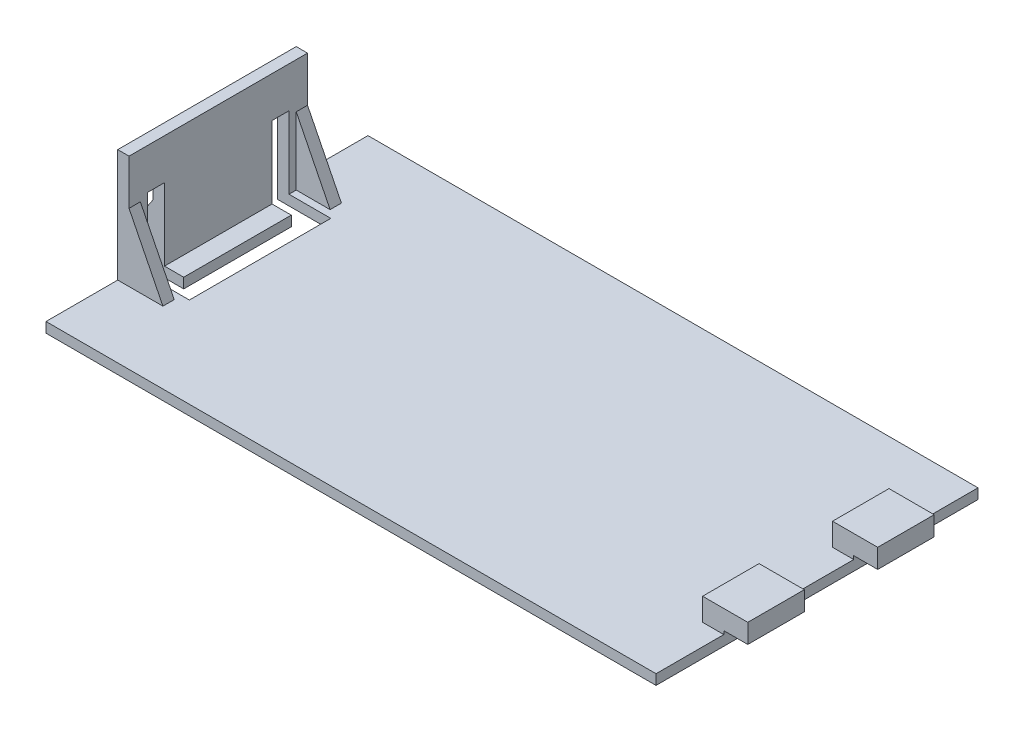
from build123d import *

# Parameters (mm, degrees)
SALIENTE_EXTRUIR1_DEPTH  = 0.9
CROQUIS2_W               = 1.87835833
CROQUIS2_H               = 5
SALIENTE_EXTRUIR2_DEPTH  = 0.3
CROQUIS3_W               = 4
CROQUIS3_H               = 5
SALIENTE_EXTRUIR4_DEPTH  = 1.7
CROQUIS4_W               = 4
CROQUIS4_H               = 5
SALIENTE_EXTRUIR5_DEPTH  = 1.7
CROQUIS5_W               = 1
CROQUIS5_H               = 15.8
SALIENTE_EXTRUIR6_DEPTH  = 10
SALIENTE_EXTRUIR8_START  = -3.14
SALIENTE_EXTRUIR8_DEPTH  = 2.16
SALIENTE_EXTRUIR9_START  = -3.14
SALIENTE_EXTRUIR9_DEPTH  = 2.16
SALIENTE_EXTRUIR10_DEPTH = 1
SALIENTE_EXTRUIR11_DEPTH = 1
CROQUIS14_W              = 1.5
CROQUIS14_H              = 7.3
CORTAR_EXTRUIR1_DEPTH    = 4.7
CROQUIS16_W              = 2
CROQUIS16_H              = 9.52
CORTAR_EXTRUIR2_DEPTH    = 4.7


with BuildPart() as part:
    # Croquis1 → Saliente-Extruir1 (new body)
    with BuildSketch(Plane(origin=(0, 0, 0), x_dir=(1, 0, 0), z_dir=(0, 1, 0))):
        Polygon((-13.741322015, -0.507016954), (-13.741322015, -12.507016954), (40.258677985, -12.507016954), (40.258677985, 15.992983046), (-13.741322015, 15.992983046), (-13.741322015, 3.992983046), (-15.191322015, 3.992983046), (-15.191322015, -0.507016954), align=None)
    extrude(amount=SALIENTE_EXTRUIR1_DEPTH)

    # Croquis2 → Saliente-Extruir2 (add)
    with BuildSketch(Plane(origin=(0, 0.9, 0), x_dir=(1, 0, 0), z_dir=(0, 1, 0))):
        with Locations((39.31949882, -4.007016954)):
            Rectangle(CROQUIS2_W, CROQUIS2_H)
        with Locations((39.31949882, 7.492983046)):
            Rectangle(CROQUIS2_W, CROQUIS2_H)
    extrude(amount=SALIENTE_EXTRUIR2_DEPTH)

    # Croquis3 → Saliente-Extruir4 (add)
    with BuildSketch(Plane(origin=(0, 1.2, 0), x_dir=(1, 0, 0), z_dir=(0, 1, 0))):
        with Locations((40.380319655, -4.007016954)):
            Rectangle(CROQUIS3_W, CROQUIS3_H)
    extrude(amount=SALIENTE_EXTRUIR4_DEPTH)

    # Croquis4 → Saliente-Extruir5 (add)
    with BuildSketch(Plane(origin=(0, 1.2, 0), x_dir=(1, 0, 0), z_dir=(0, 1, 0))):
        with Locations((40.380319655, 7.492983046)):
            Rectangle(CROQUIS4_W, CROQUIS4_H)
    extrude(amount=SALIENTE_EXTRUIR5_DEPTH)

    # Croquis5 → Saliente-Extruir6 (add)
    with BuildSketch(Plane(origin=(0, 0.9, 0), x_dir=(1, 0, 0), z_dir=(0, 1, 0))):
        with Locations((-13.241322015, 1.742983046)):
            Rectangle(CROQUIS5_W, CROQUIS5_H)
    extrude(amount=SALIENTE_EXTRUIR6_DEPTH)

    # Croquis6 → Saliente-Extruir8 (add)
    with BuildSketch(Plane(origin=(0, 0, -9.642983046), x_dir=(-1, 0, 0), z_dir=(0, 0, -1)).offset(SALIENTE_EXTRUIR8_START)):
        Polygon((13.741322015, 2.5), (13.741322015, 5.5), (15.741322015, 2.5), align=None)
    extrude(amount=-SALIENTE_EXTRUIR8_DEPTH)

    # Croquis9 → Saliente-Extruir9 (add)
    with BuildSketch(Plane.XY.offset(6.157016954).offset(SALIENTE_EXTRUIR9_START)):
        Polygon((-15.741322015, 2.5), (-13.741322015, 5.5), (-13.741322015, 2.5), align=None)
    extrude(amount=-SALIENTE_EXTRUIR9_DEPTH)

    # Croquis12 → Saliente-Extruir10 (add)
    with BuildSketch(Plane(origin=(0, 0, -9.642983046), x_dir=(-1, 0, 0), z_dir=(0, 0, -1))):
        Polygon((12.741322015, 0.9), (9.741322015, 0.9), (12.741322015, 6.9), align=None)
    extrude(amount=-SALIENTE_EXTRUIR10_DEPTH)

    # Croquis13 → Saliente-Extruir11 (add)
    with BuildSketch(Plane.XY.offset(6.157016954)):
        Polygon((-12.741322015, 0.9), (-9.741322015, 0.9), (-12.741322015, 6.9), align=None)
    extrude(amount=-SALIENTE_EXTRUIR11_DEPTH)

    # Croquis14 → Cortar-Extruir1 (cut)
    with BuildSketch(Plane.ZY.offset(13.741322015)):
        with Locations((3.767016954, 3.65)):
            Rectangle(CROQUIS14_W, CROQUIS14_H)
        with Locations((-7.252983046, 3.65)):
            Rectangle(CROQUIS14_W, CROQUIS14_H)
    extrude(amount=-CORTAR_EXTRUIR1_DEPTH, mode=Mode.SUBTRACT)

    # Croquis16 → Cortar-Extruir2 (cut)
    with BuildSketch(Plane(origin=(0, 0.9, 0), x_dir=(1, 0, 0), z_dir=(0, 1, 0))):
        with Locations((-10.041322015, 1.742983046)):
            Rectangle(CROQUIS16_W, CROQUIS16_H)
    extrude(amount=-CORTAR_EXTRUIR2_DEPTH, mode=Mode.SUBTRACT)


solid = part.part
